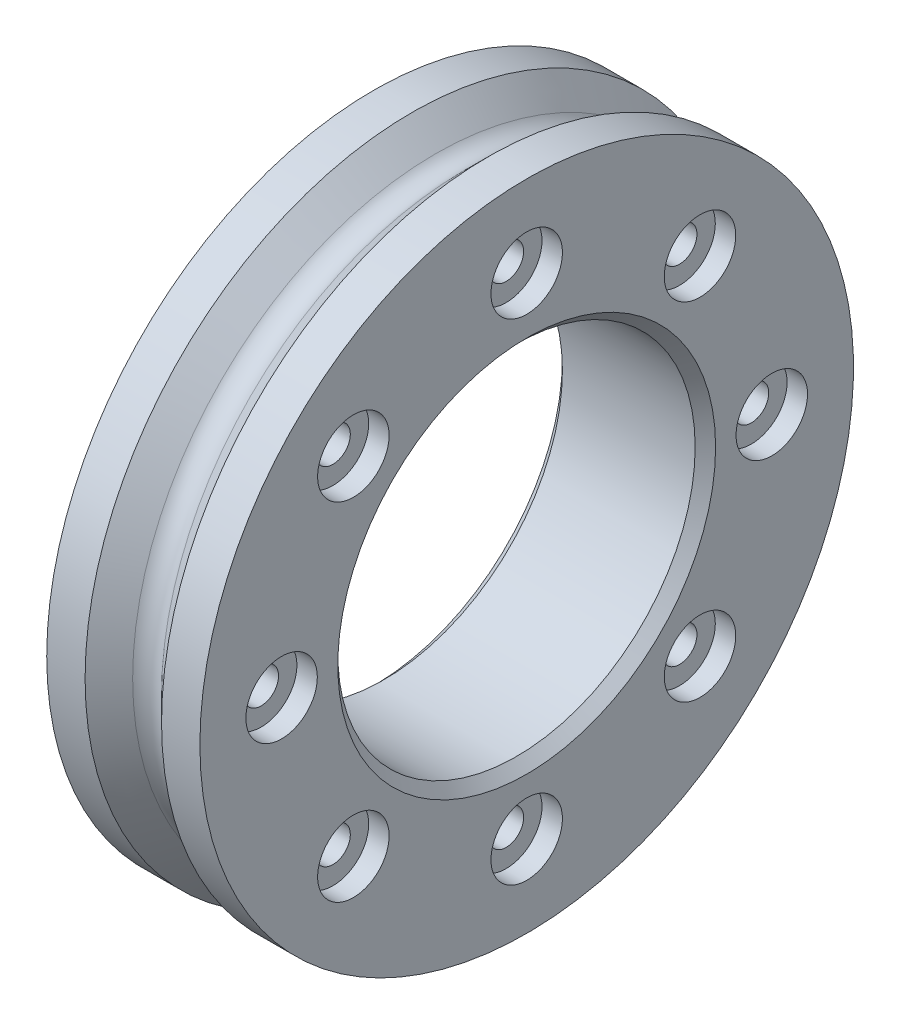
from build123d import *

# Parameters (mm, degrees)
CHAMFER1_SIZE                                = 1
FILLET1_R                                    = 2
CBORE_FOR_M3_HEX_HEAD_CAP_SCREW1_D           = 3.4
CBORE_FOR_M3_HEX_HEAD_CAP_SCREW1_CBORE_D     = 7
CBORE_FOR_M3_HEX_HEAD_CAP_SCREW1_CBORE_DEPTH = 2
CIRPATTERN1_COUNT                            = 8


with BuildPart() as part:
    # Sketch1 → Revolve1 (revolve)
    with BuildSketch(Plane.XY, mode=Mode.PRIVATE) as revolve1_sk:
        Polygon((7.5, 32), (3.742640687, 32), (0, 28.257359313), (-3.742640687, 32), (-7.5, 32), (-7.5, 17.5), (7.5, 17.5), align=None)
    revolve(revolve1_sk.sketch.rotate(Axis((-33.732241936, 0, 0), (1, 0, 0)), 90), axis=Axis((-33.732241936, 0, 0), (1, 0, 0)))

    # Chamfer1
    chamfer1_edges = [part.edges().sort_by_distance(p)[0] for p in [
        (7.5, 0, -17.5),
        (-7.5, 0, -17.5),
    ]]
    chamfer(chamfer1_edges, length=CHAMFER1_SIZE)

    # Fillet1
    fillet1_edges = [part.edges().sort_by_distance(p)[0] for p in [
        (0, 0, -28.257359313),
    ]]
    fillet(fillet1_edges, radius=FILLET1_R)

    # CBORE for M3 Hex Head Cap Screw1 (through all)
    with Locations(Plane(origin=(7.5, 24, 0), x_dir=(0, 0, 1), z_dir=(1, 0, 0))):
        with Locations((0, 0)):
            cbore_for_m3_hex_head_cap_screw1 = CounterBoreHole(CBORE_FOR_M3_HEX_HEAD_CAP_SCREW1_D / 2, CBORE_FOR_M3_HEX_HEAD_CAP_SCREW1_CBORE_D / 2, CBORE_FOR_M3_HEX_HEAD_CAP_SCREW1_CBORE_DEPTH)

    # CirPattern1: CBORE for M3 Hex Head Cap Screw1 ×8 about axis
    cirpattern1_axis = Axis((0, 0, 0), (1, 0, 0))
    for i in range(1, CIRPATTERN1_COUNT):
        add(cbore_for_m3_hex_head_cap_screw1.rotate(cirpattern1_axis, i * 360 / CIRPATTERN1_COUNT), mode=Mode.SUBTRACT)


solid = part.part
